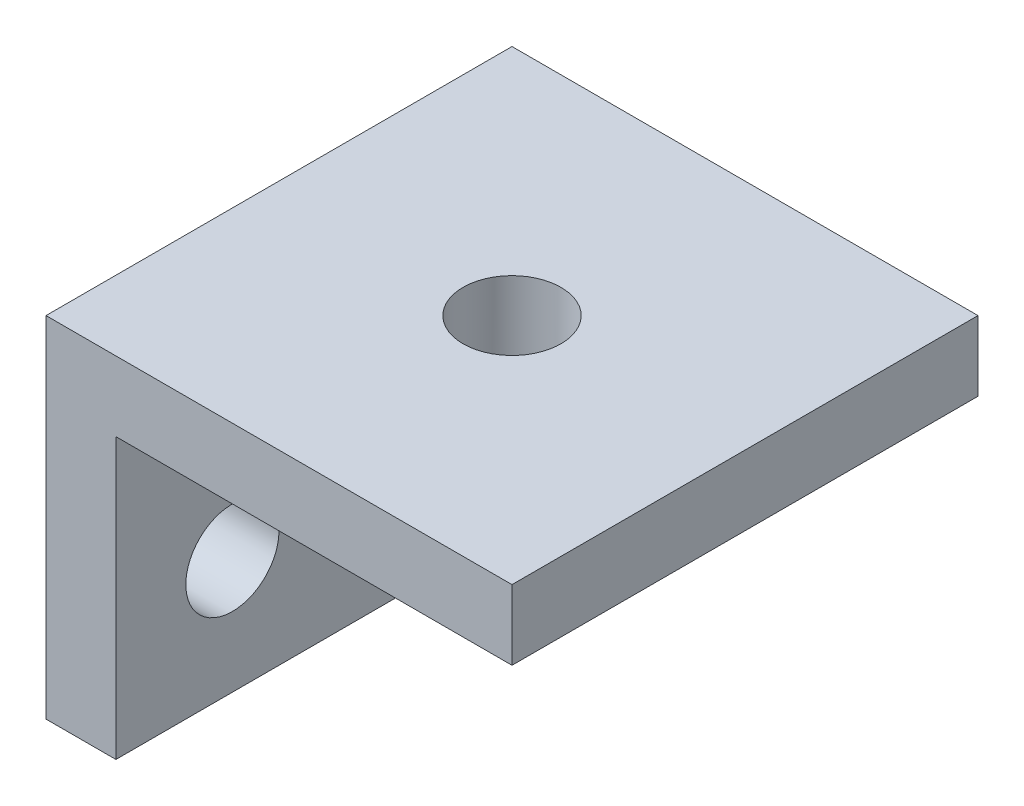
from build123d import *

# Parameters (mm, degrees)
SKETCH_1_W                  = 20
SKETCH_1_H                  = 20
EXTRUDE_1_DEPTH             = 15
SKETCH_2_W                  = 17
SKETCH_2_H                  = 12
CUT_EXTRUDE_1_DEPTH         = 49.176757882
HOLE_WIZARD_4_2_4_2_1_D     = 4.2
HOLE_WIZARD_4_2_4_2_1_DEPTH = 15
HOLE_WIZARD_4_0_4_1_D       = 4


with BuildPart() as part:
    # 草图1 → 凸台-拉伸1 (new body)
    with BuildSketch(Plane.XZ.offset(25)):
        with Locations((-26, 10)):
            Rectangle(SKETCH_1_W, SKETCH_1_H)
    extrude(amount=-EXTRUDE_1_DEPTH)

    # 草图2 → 切除-拉伸1 (cut, through all)
    with BuildSketch(Plane(origin=(0, 0, 0), x_dir=(-1, 0, 0), z_dir=(0, 0, -1))):
        with Locations((24.5, -19)):
            Rectangle(SKETCH_2_W, SKETCH_2_H)
    extrude(amount=-CUT_EXTRUDE_1_DEPTH, mode=Mode.SUBTRACT)

    # Ø4.2 (4.2) 直径孔1
    with Locations(Plane(origin=(0, -10, 0), x_dir=(1, 0, 0), z_dir=(0, 1, 0))):
        with Locations((-26, -10)):
            Hole(HOLE_WIZARD_4_2_4_2_1_D / 2, depth=HOLE_WIZARD_4_2_4_2_1_DEPTH)

    # Ø4.0 (4) 直径孔1 (through all)
    with Locations(Plane(origin=(-33, 0, 0), x_dir=(0, 0, -1), z_dir=(1, 0, 0))):
        with Locations((-15, -20), (-5, -20)):
            Hole(HOLE_WIZARD_4_0_4_1_D / 2)


solid = part.part
